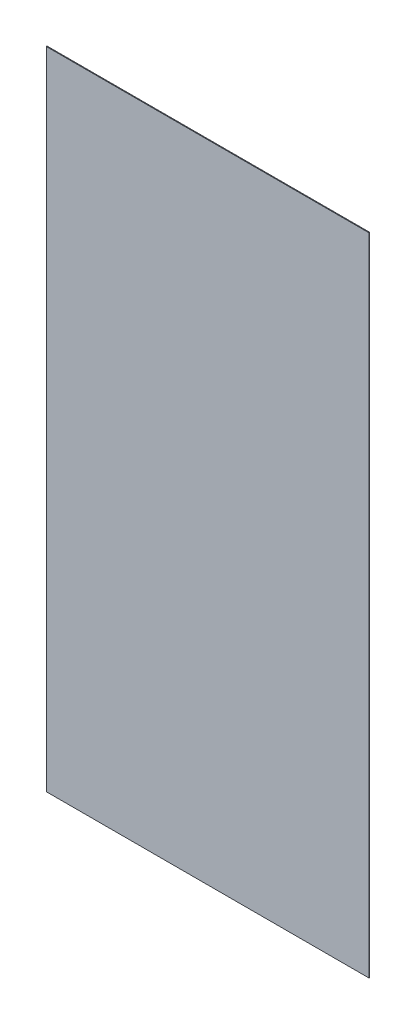
from build123d import *

# Parameters (mm, degrees)
SKETCH1_W           = 1219.2
SKETCH1_H           = 2438.4
BOSS_EXTRUDE1_DEPTH = 3


with BuildPart() as part:
    # Sketch1 → Boss-Extrude1 (new body)
    with BuildSketch(Plane.XY):
        Rectangle(SKETCH1_W, SKETCH1_H)
    extrude(amount=BOSS_EXTRUDE1_DEPTH)


solid = part.part
